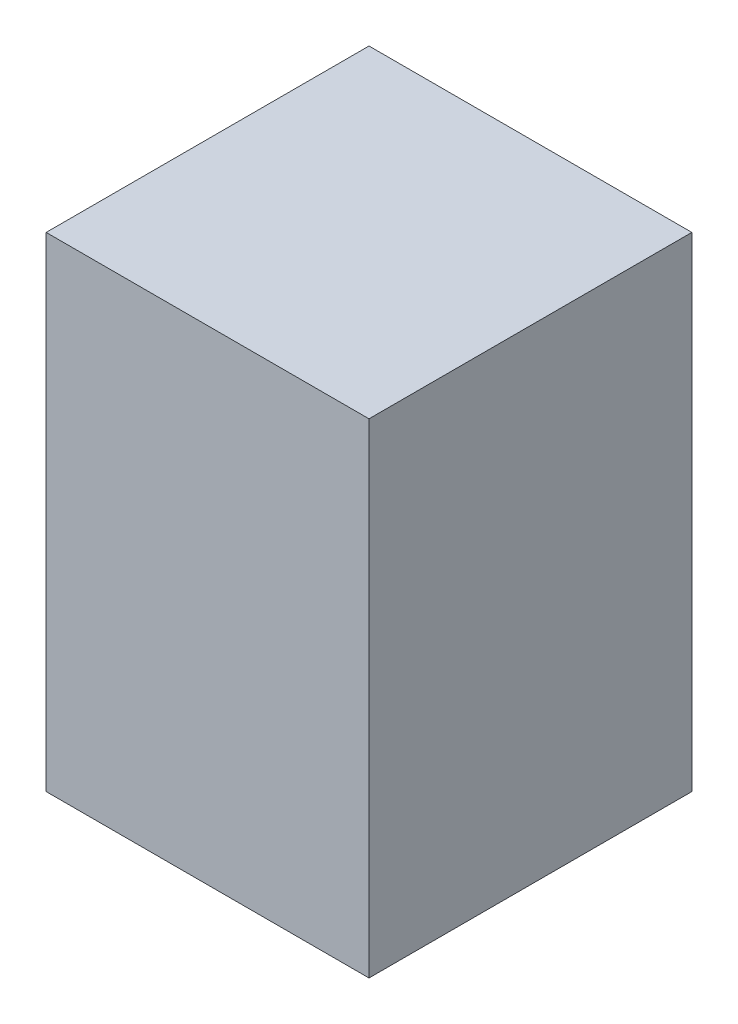
from build123d import *

# Parameters (mm, degrees)
SKETCH1_W           = 500
SKETCH1_H           = 750
BOSS_EXTRUDE1_DEPTH = 500
SKETCH2_W           = 476
SKETCH2_H           = 726
CUT_EXTRUDE1_DEPTH  = 488
SKETCH3_W           = 6
SKETCH3_H           = 14
CUT_EXTRUDE2_DEPTH  = 488


with BuildPart() as part:
    # Sketch1 → Boss-Extrude1 (new body)
    with BuildSketch(Plane.XY):
        with Locations((250, 375)):
            Rectangle(SKETCH1_W, SKETCH1_H)
    extrude(amount=BOSS_EXTRUDE1_DEPTH)

    # Sketch2 → Cut-Extrude1 (cut)
    with BuildSketch(Plane(origin=(0, 0, 0), x_dir=(-1, 0, 0), z_dir=(0, 0, -1))):
        with Locations((-250, 375)):
            Rectangle(SKETCH2_W, SKETCH2_H)
    extrude(amount=-CUT_EXTRUDE1_DEPTH, mode=Mode.SUBTRACT)

    # Sketch3 → Cut-Extrude2 (cut)
    with BuildSketch(Plane(origin=(0, 0, 0), x_dir=(-1, 0, 0), z_dir=(0, 0, -1))):
        with Locations((-491, 250)):
            Rectangle(SKETCH3_W, SKETCH3_H)
        with Locations((-491, 500)):
            Rectangle(SKETCH3_W, SKETCH3_H)
        with Locations((-9, 500)):
            Rectangle(SKETCH3_W, SKETCH3_H)
        with Locations((-9, 250)):
            Rectangle(SKETCH3_W, SKETCH3_H)
    extrude(amount=-CUT_EXTRUDE2_DEPTH, mode=Mode.SUBTRACT)


solid = part.part
